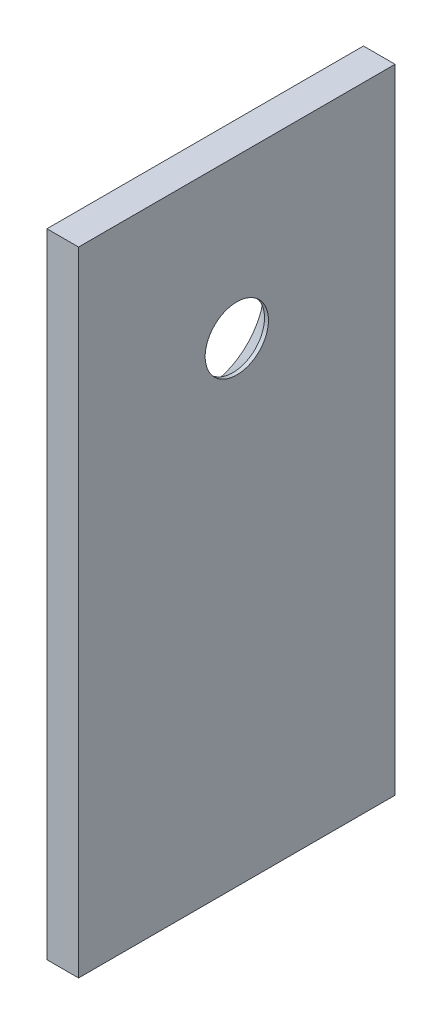
from build123d import *

# Parameters (mm, degrees)
SKETCH1_W           = 40
SKETCH1_H           = 80
SKETCH1_R           = 4
BOSS_EXTRUDE1_DEPTH = 4
CHAMFER1_SIZE       = 3.5


with BuildPart() as part:
    # Sketch1 → Boss-Extrude1 (new body)
    with BuildSketch(Plane(origin=(0, 0, 0), x_dir=(0, 0, -1), z_dir=(1, 0, 0))):
        with Locations((0, -82.5)):
            Rectangle(SKETCH1_W, SKETCH1_H)
        with Locations((0, -62.5)):
            Circle(SKETCH1_R, mode=Mode.SUBTRACT)
    extrude(amount=BOSS_EXTRUDE1_DEPTH)

    # Chamfer1
    chamfer1_edges = [part.edges().sort_by_distance(p)[0] for p in [
        (0, -62.5, 4),
    ]]
    chamfer(chamfer1_edges, length=CHAMFER1_SIZE)


solid = part.part
